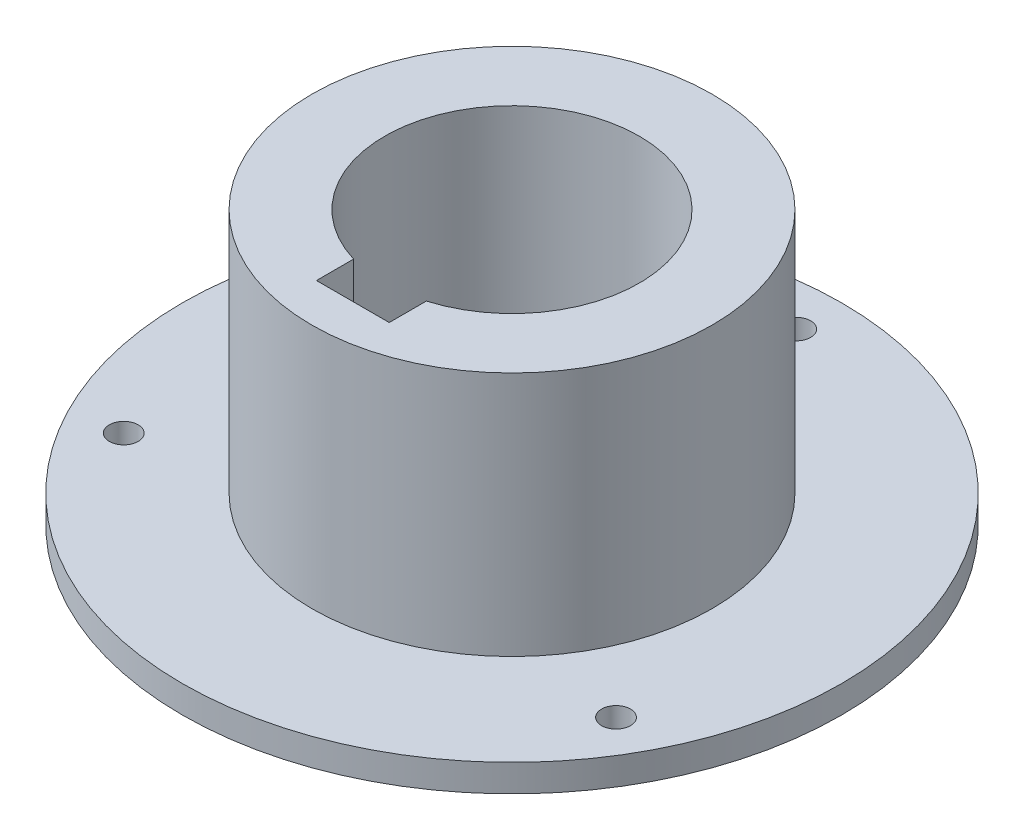
from build123d import *

# Parameters (mm, degrees)
F_1_8_0_125_DIAMETER_HOLE1_D = 3.175
CIRPATTERN1_COUNT            = 3
CUT_EXTRUDE2_DEPTH           = 61.432813934


with BuildPart() as part:
    # Sketch1 → Revolve1 (revolve)
    with BuildSketch(Plane.XY, mode=Mode.PRIVATE) as revolve1_sk:
        Polygon((22, 30), (22, 3), (36.25, 3), (36.25, 0), (19.25, 0), (19.25, -2), (14, -2), (14, 30), align=None)
    revolve(revolve1_sk.sketch.rotate(Axis((0, 0, 0), (0, 1, 0)), 90), axis=Axis((0, 0, 0), (0, 1, 0)))

    # 1/8 (0.125) Diameter Hole1 (through all)
    with Locations(Plane(origin=(0, 3, 0), x_dir=(1, 0, 0), z_dir=(0, 1, 0))):
        with Locations((0, 31.25)):
            f_1_8_0_125_diameter_hole1 = Hole(F_1_8_0_125_DIAMETER_HOLE1_D / 2)

    # CirPattern1: 1/8 (0.125) Diameter Hole1 ×3 about axis
    cirpattern1_axis = Axis((0, 0, 0), (0, 1, 0))
    for i in range(1, CIRPATTERN1_COUNT):
        add(f_1_8_0_125_diameter_hole1.rotate(cirpattern1_axis, i * 360 / CIRPATTERN1_COUNT), mode=Mode.SUBTRACT)

    # Sketch7 → Cut-Extrude2 (cut, through all)
    with BuildSketch(Plane(origin=(0, 30, 0), x_dir=(1, 0, 0), z_dir=(0, 1, 0))):
        Polygon((0, -17.5), (4, -17.5), (4, -12.919453698), (-4, -12.919453698), (-4, -17.5), align=None)
    extrude(amount=-CUT_EXTRUDE2_DEPTH, mode=Mode.SUBTRACT)


solid = part.part
